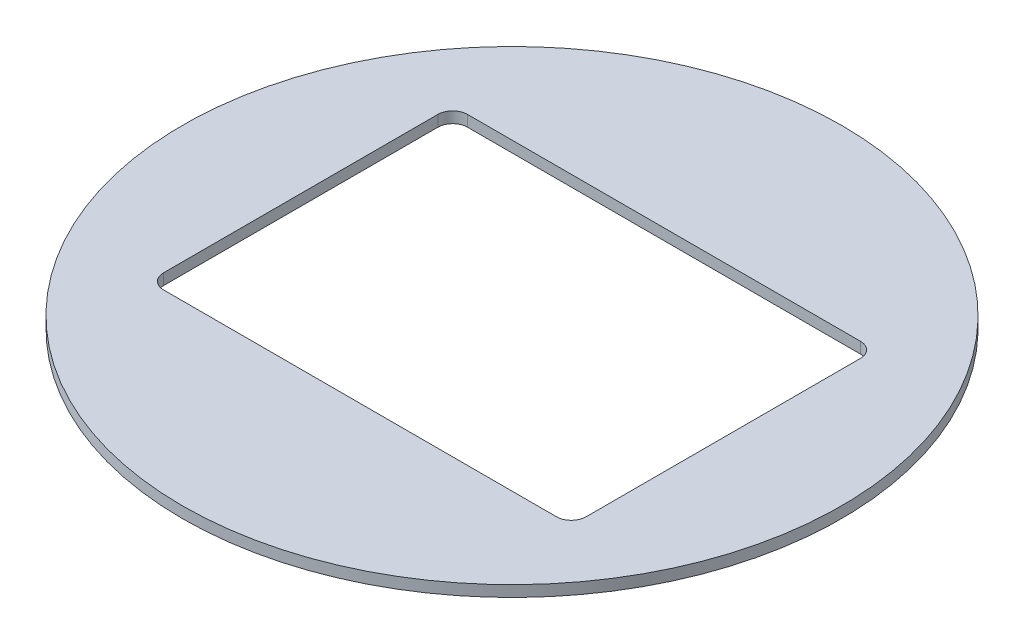
from build123d import *

# Parameters (mm, degrees)
SKETCH1_R           = 88.9
BOSS_EXTRUDE1_DEPTH = 3
CUT_EXTRUDE2_DEPTH  = 3


with BuildPart() as part:
    # Sketch1 → Boss-Extrude1 (new body)
    with BuildSketch(Plane(origin=(0, 0, 0), x_dir=(1, 0, 0), z_dir=(0, 1, 0))):
        with Locations(Location((0, 0, 0), (0, 0, 270))):
            Circle(SKETCH1_R)
    extrude(amount=BOSS_EXTRUDE1_DEPTH)

    # Sketch3 → Cut-Extrude2 (cut)
    with BuildSketch(Plane.XZ):
        with BuildLine():
            Line((53, -41), (-53, -41))
            ThreePointArc((-53, -41), (-55.828427125, -39.828427125), (-57, -37))
            Line((-57, -37), (-57, 37))
            ThreePointArc((-57, 37), (-55.828427125, 39.828427125), (-53, 41))
            Line((-53, 41), (53, 41))
            ThreePointArc((53, 41), (55.828427125, 39.828427125), (57, 37))
            Line((57, 37), (57, -37))
            ThreePointArc((57, -37), (55.828427125, -39.828427125), (53, -41))
        make_face()
    extrude(amount=-CUT_EXTRUDE2_DEPTH, mode=Mode.SUBTRACT)


solid = part.part
